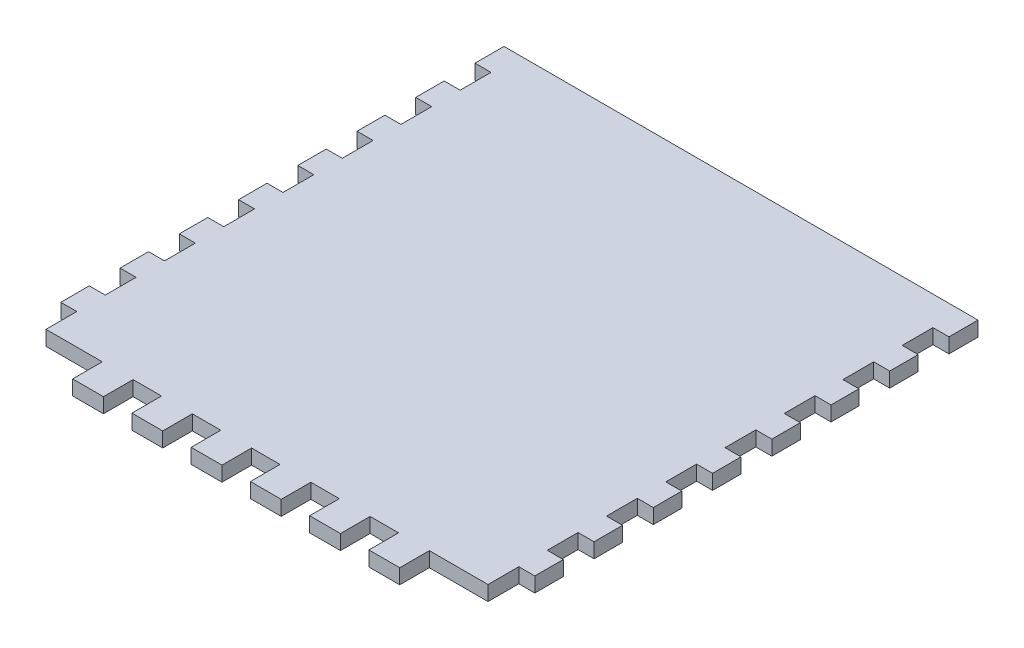
from build123d import *

# Parameters (mm, degrees)
SKETCH1_W               = 101.6
SKETCH1_H               = 107.95
BOSS_EXTRUDE1_DEPTH     = 3.175
CUT_EXTRUDE1_DEPTH      = 75.189091179
CUT_EXTRUDE1_DEPTH_BACK = 75.189091179
SKETCH2_W               = 3.429
SKETCH2_H               = 6.604


with BuildPart() as part:
    # Sketch1 → Boss-Extrude1 (new body)
    with BuildSketch(Plane(origin=(0, 0, 0), x_dir=(1, 0, 0), z_dir=(0, 1, 0))):
        Rectangle(SKETCH1_W, SKETCH1_H)
    extrude(amount=BOSS_EXTRUDE1_DEPTH)

    # Sketch2 → Cut-Extrude1 (cut, two sides: drawn at the far end of the back side and taken through both)
    with BuildSketch(Plane(origin=(0, 3.175, 0), x_dir=(1, 0, 0), z_dir=(0, 1, 0)).offset(-CUT_EXTRUDE1_DEPTH_BACK)):
        Polygon((22.098, -47.625), (28.194, -47.625), (28.194, -54.229), (34.798, -54.229), (34.798, -47.625), (47.371, -47.625), (47.371, -41.021), (50.8, -41.021), (50.8, -47.625), (50.8, -92.544961432), (-50.8, -92.544961432), (-50.8, -47.625), (-50.8, -41.021), (-47.371, -41.021), (-47.371, -47.625), (-35.306, -47.625), (-35.306, -54.229), (-28.702, -54.229), (-28.702, -47.625), (-22.606, -47.625), (-22.606, -54.229), (-16.002, -54.229), (-16.002, -47.625), (-9.906, -47.625), (-9.906, -54.229), (-3.302, -54.229), (-3.302, -47.625), (2.794, -47.625), (2.794, -54.229), (9.398, -54.229), (9.398, -47.625), (15.494, -47.625), (15.494, -54.229), (22.098, -54.229), align=None)
        with Locations((-49.0855, 31.75)):
            Rectangle(SKETCH2_W, SKETCH2_H)
        with Locations((-49.0855, 19.177)):
            Rectangle(SKETCH2_W, SKETCH2_H)
        with Locations((-49.0855, 6.477)):
            Rectangle(SKETCH2_W, SKETCH2_H)
        with Locations((-49.0855, -6.223)):
            Rectangle(SKETCH2_W, SKETCH2_H)
        with Locations((-49.0855, -18.923)):
            Rectangle(SKETCH2_W, SKETCH2_H)
        with Locations((-49.0855, -31.623)):
            Rectangle(SKETCH2_W, SKETCH2_H)
        with Locations((49.0855, -31.623)):
            Rectangle(SKETCH2_W, SKETCH2_H)
        with Locations((49.0855, -18.923)):
            Rectangle(SKETCH2_W, SKETCH2_H)
        with Locations((49.0855, -6.223)):
            Rectangle(SKETCH2_W, SKETCH2_H)
        with Locations((49.0855, 6.477)):
            Rectangle(SKETCH2_W, SKETCH2_H)
        with Locations((49.0855, 19.177)):
            Rectangle(SKETCH2_W, SKETCH2_H)
        with Locations((49.0855, 31.75)):
            Rectangle(SKETCH2_W, SKETCH2_H)
        with Locations((49.0855, 44.45)):
            Rectangle(SKETCH2_W, SKETCH2_H)
        with Locations((-49.0855, 44.45)):
            Rectangle(SKETCH2_W, SKETCH2_H)
    extrude(amount=CUT_EXTRUDE1_DEPTH + CUT_EXTRUDE1_DEPTH_BACK, mode=Mode.SUBTRACT)


solid = part.part
